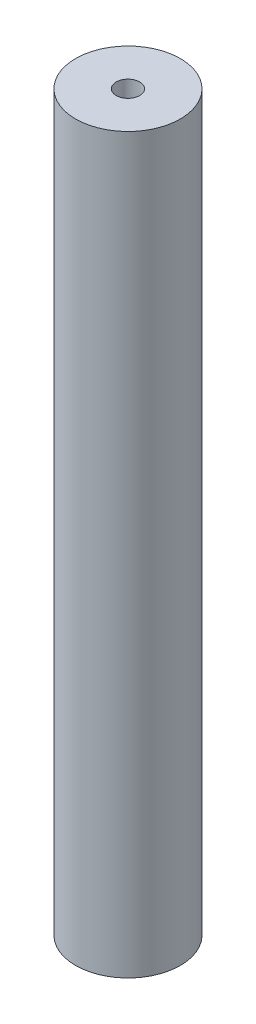
from build123d import *

# Parameters (mm, degrees)
SKETCH_1_R      = 10
EXTRUDE_1_DEPTH = 70


with BuildPart() as part:
    # Эскиз1 → Бобышка-Вытянуть1 (new body)
    with BuildSketch(Plane(origin=(0, 0, 0), x_dir=(1, 0, 0), z_dir=(0, 1, 0))):
        with Locations(Location((0, 0, 0), (0, 0, 270))):
            Circle(SKETCH_1_R)
    extrude_1 = extrude(amount=EXTRUDE_1_DEPTH)

    # Эскиз4 → Отверстие с зазором M41 (revolve, cut)
    with BuildSketch(Plane(origin=(0, 70, 0), x_dir=(0, 0, 1), z_dir=(1, 0, 0))):
        Polygon((0, 0), (0, 17.351936393), (2.25, 16), (2.25, 0), align=None)
    hole_wizard_m41 = revolve(axis=Axis((0, 76.35, 0), (0, -1, 0)), mode=Mode.SUBTRACT)

    # Зеркальное отражение1: Бобышка-Вытянуть1, Отверстие с зазором M41 across plane
    add(extrude_1.mirror(Plane.ZX))
    add(hole_wizard_m41.mirror(Plane.ZX), mode=Mode.SUBTRACT)


solid = part.part
